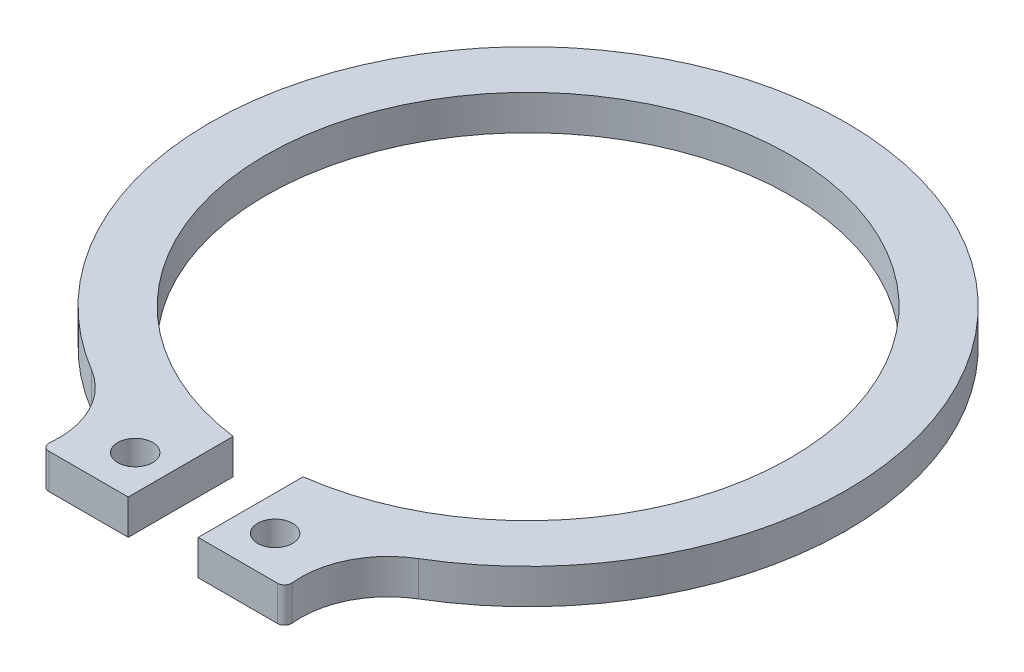
from build123d import *

# Parameters (mm, degrees)
SKETCH1_R           = 0.635
BOSS_EXTRUDE1_DEPTH = 1.27
FILLET1_R           = 0.254


with BuildPart() as part:
    # Sketch1 → Boss-Extrude1 (new body)
    with BuildSketch(Plane(origin=(0, 0, 0), x_dir=(1, 0, 0), z_dir=(0, 1, 0))):
        with BuildLine():
            ThreePointArc((-4.445, -13.249953655), (-4.662189736, -11.349360189), (-5.931882655, -9.9185189))
            ThreePointArc((-5.931882655, -9.9185189), (0, 11.557), (5.931882655, -9.9185189))
            ThreePointArc((5.931882655, -9.9185189), (4.662189736, -11.349360189), (4.445, -13.249953655))
            Line((4.445, -13.249953655), (1.27, -13.249953655))
            Line((1.27, -13.249953655), (1.27, -9.439953655))
            ThreePointArc((1.27, -9.439953655), (0, 9.525), (-1.27, -9.439953655))
            Line((-1.27, -9.439953655), (-1.27, -13.249953655))
            Line((-1.27, -13.249953655), (-4.445, -13.249953655))
        make_face()
        with Locations(Location((2.54, -11.725953655, 0), (0, 0, 270))):
            Circle(SKETCH1_R, mode=Mode.SUBTRACT)
        with Locations(Location((-2.54, -11.725953655, 0), (0, 0, 270))):
            Circle(SKETCH1_R, mode=Mode.SUBTRACT)
    extrude(amount=BOSS_EXTRUDE1_DEPTH)

    # Fillet1
    fillet1_edges = [part.edges().sort_by_distance(p)[0] for p in [
        (4.445, 0.635, 13.249953655),
        (-4.445, 0.635, 13.249953655),
    ]]
    fillet(fillet1_edges, radius=FILLET1_R)


solid = part.part
